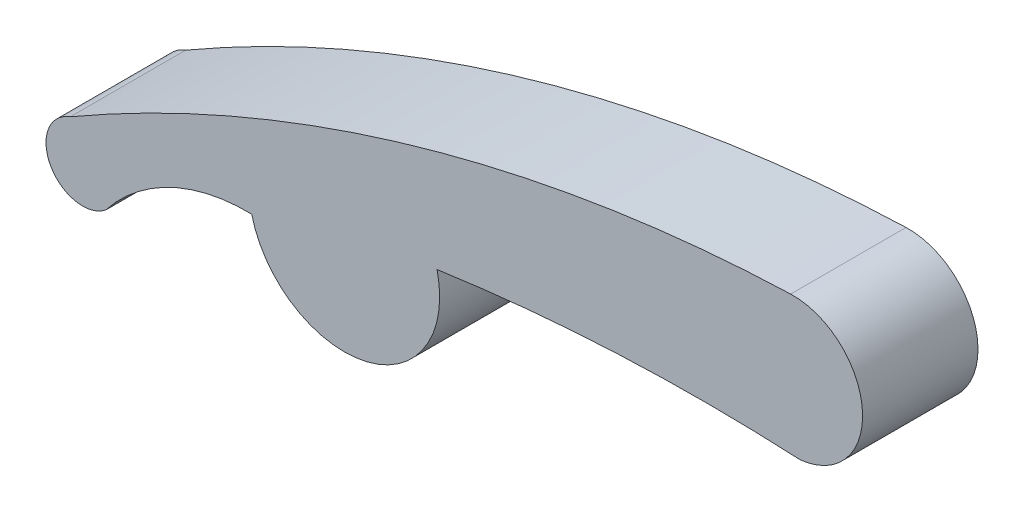
from build123d import *

# Parameters (mm, degrees)
EXTRUDE_1_DEPTH = 30


with BuildPart() as part:
    # 草图2 → 凸台-拉伸1 (new body)
    with BuildSketch(Plane.XY):
        with BuildLine():
            ThreePointArc((-61.992477784, -23.802811236), (-45.175134734, -10.309943663), (-24.087895886, -5.814517058))
            ThreePointArc((-24.087895886, -5.814517058), (5.816738592, -24.087359527), (24.086822963, 5.818960077))
            ThreePointArc((24.086822963, 5.818960077), (71.178401436, 10.304676326), (118.482977133, 10.180051405))
            ThreePointArc((118.482977133, 10.180051405), (134.695685991, 29.406248821), (116.030457789, 46.261747975))
            ThreePointArc((116.030457789, 46.261747975), (19.051258644, 30.943293914), (-71.299428674, -7.480310846))
            ThreePointArc((-71.299428674, -7.480310846), (-76.322488893, -21.159039372), (-61.992477784, -23.802811236))
        make_face()
    extrude(amount=EXTRUDE_1_DEPTH)


solid = part.part
